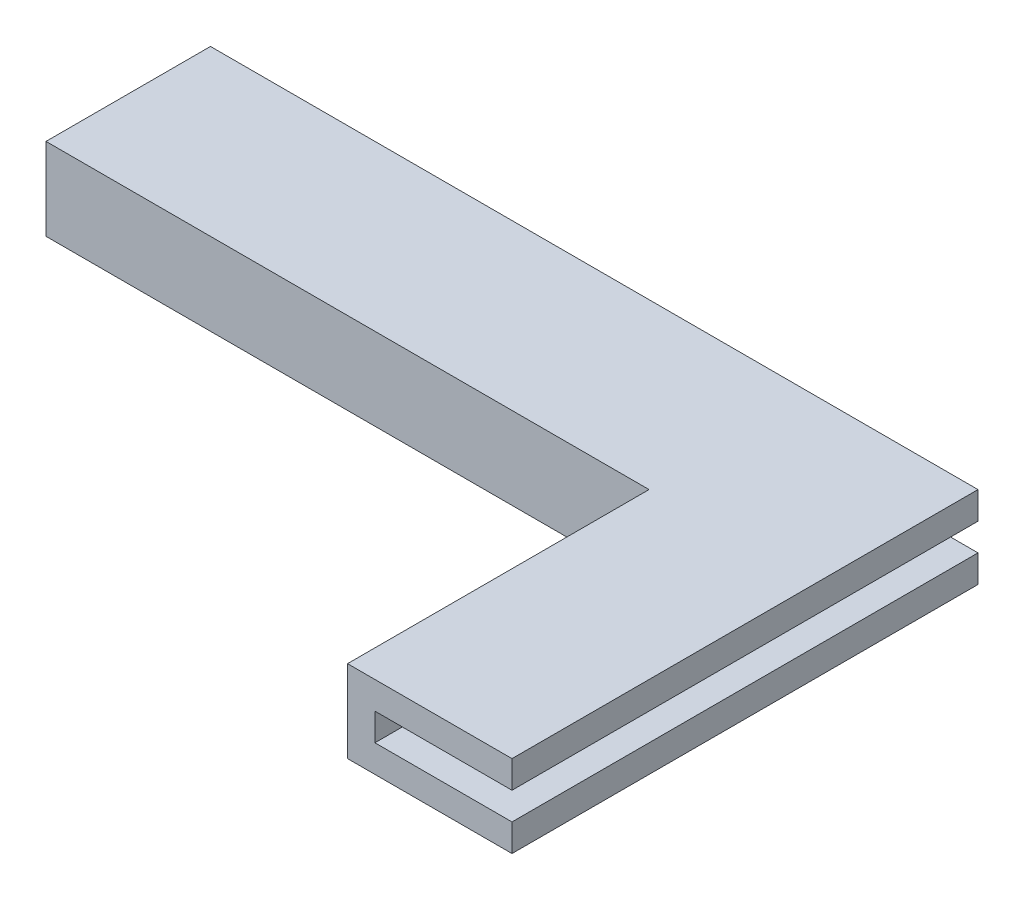
from build123d import *

# Parameters (mm, degrees)
SKETCH1_W             = 28
SKETCH1_H             = 1
BOSS_EXTRUDE1_DEPTH   = 5
BOSS_EXTRUDE1_2_DEPTH = 5
BOSS_EXTRUDE2_DEPTH   = 1
BOSS_EXTRUDE3_DEPTH   = 11


with BuildPart() as part:
    # Sketch1 → Boss-Extrude1 (new body)
    with BuildSketch(Plane.XY):
        with Locations((14, 0.5)):
            Rectangle(SKETCH1_W, SKETCH1_H)
    extrude(amount=BOSS_EXTRUDE1_DEPTH)



with BuildPart() as body_2:
    # Sketch1 → Boss-Extrude1 2 (new body)
    with BuildSketch(Plane.XY):
        with Locations((14, 2.5)):
            Rectangle(SKETCH1_W, SKETCH1_H)
    extrude(amount=BOSS_EXTRUDE1_2_DEPTH)


with BuildPart() as part_1:
    add(part.part)

    add(body_2.part)  # Boss-Extrude2 merges body 2
    # Sketch2 → Boss-Extrude2 (add)
    with BuildSketch(Plane.XY.offset(5)):
        Polygon((0, 3), (28, 3), (28, 2), (23, 2), (23, 1), (28, 1), (28, 0), (0, 0), align=None)
    extrude(amount=BOSS_EXTRUDE2_DEPTH)

    # Sketch3 → Boss-Extrude3 (add)
    with BuildSketch(Plane.XY.offset(6)):
        Polygon((28, 3), (22, 3), (22, 0), (28, 0), (28, 1), (23, 1), (23, 2), (28, 2), align=None)
    extrude(amount=BOSS_EXTRUDE3_DEPTH)


solid = part_1.part
